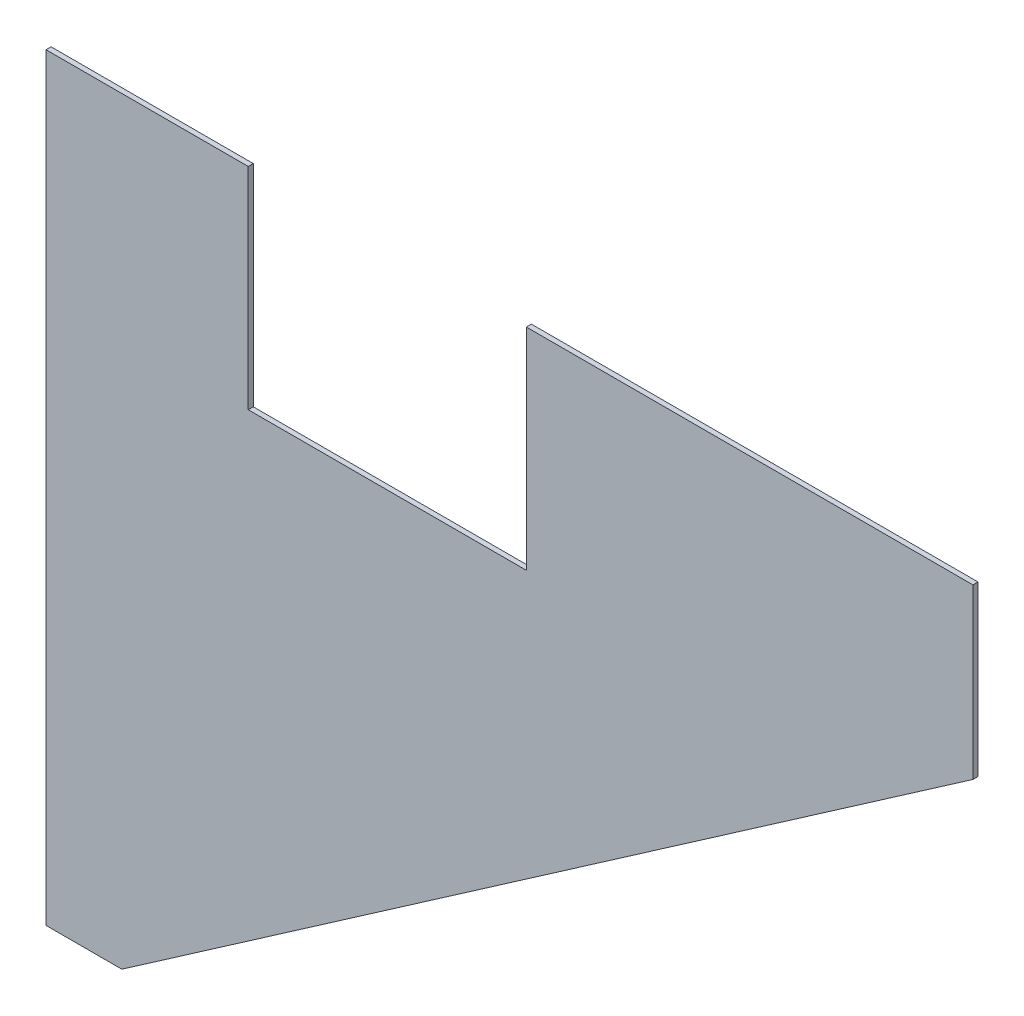
from build123d import *

# Parameters (mm, degrees)
EXTRUDE_1_DEPTH     = 6
SKETCH_2_W          = 250
SKETCH_2_H          = 250
CUT_EXTRUDE_1_DEPTH = 1361.160284672
SKETCH_3_W          = 80
SKETCH_3_H          = 250
CUT_EXTRUDE_2_DEPTH = 10


with BuildPart() as part:
    # 草图1 → 凸台-拉伸1 (new body)
    with BuildSketch(Plane.XY):
        Polygon((0, -100), (0, 800), (1100, 800), (1100, 600), (90, -100), align=None)
    extrude(amount=EXTRUDE_1_DEPTH)

    # 草图2 → 切除-拉伸1 (cut, through all)
    with BuildSketch(Plane.XY.offset(6)):
        with Locations((365, 675)):
            Rectangle(SKETCH_2_W, SKETCH_2_H)
    extrude(amount=-CUT_EXTRUDE_1_DEPTH, mode=Mode.SUBTRACT)

    # 草图3 → 切除-拉伸2 (cut)
    with BuildSketch(Plane.XY.offset(6)):
        with Locations((530, 675)):
            Rectangle(SKETCH_3_W, SKETCH_3_H)
    extrude(amount=-CUT_EXTRUDE_2_DEPTH, mode=Mode.SUBTRACT)


solid = part.part
